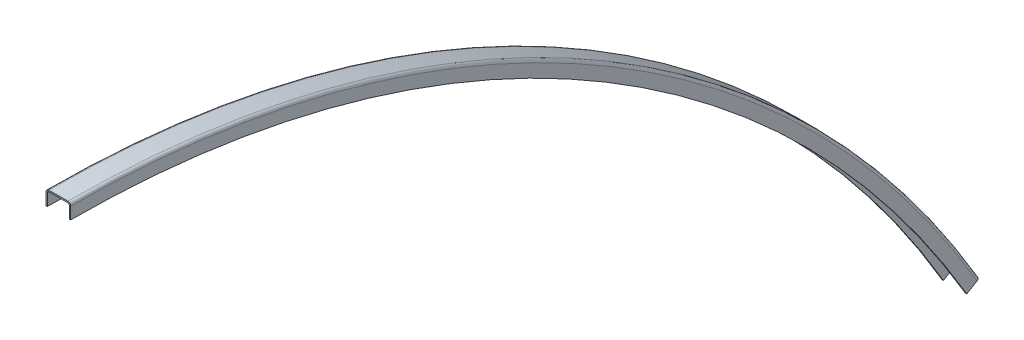
from build123d import *

# Parameters (mm, degrees)
REVOLVE1_ANGLE = 59.5


with BuildPart() as part:
    # Sketch1 → Revolve1 (revolve)
    with BuildSketch(Plane.XY):
        with BuildLine():
            Line((-23.203703704, 37.981481481), (-23.203703704, 54.981481481))
            ThreePointArc((-23.203703704, 54.981481481), (-22.032130828, 57.809908606), (-19.203703704, 58.981481481))
            Line((-19.203703704, 58.981481481), (7.796296296, 58.981481481))
            ThreePointArc((7.796296296, 58.981481481), (10.624723421, 57.809908606), (11.796296296, 54.981481481))
            Line((11.796296296, 54.981481481), (11.796296296, 37.981481481))
            Line((11.796296296, 37.981481481), (9.796296296, 37.981481481))
            Line((9.796296296, 37.981481481), (9.796296296, 54.981481481))
            ThreePointArc((9.796296296, 54.981481481), (9.210509859, 56.395695044), (7.796296296, 56.981481481))
            Line((7.796296296, 56.981481481), (-19.203703704, 56.981481481))
            ThreePointArc((-19.203703704, 56.981481481), (-20.617917266, 56.395695044), (-21.203703704, 54.981481481))
            Line((-21.203703704, 54.981481481), (-21.203703704, 37.981481481))
            Line((-21.203703704, 37.981481481), (-23.203703704, 37.981481481))
        make_face()
    revolve(axis=Axis((14.479414078, -1435.518518519, 0), (-1, 0, 0)), revolution_arc=REVOLVE1_ANGLE)


solid = part.part
